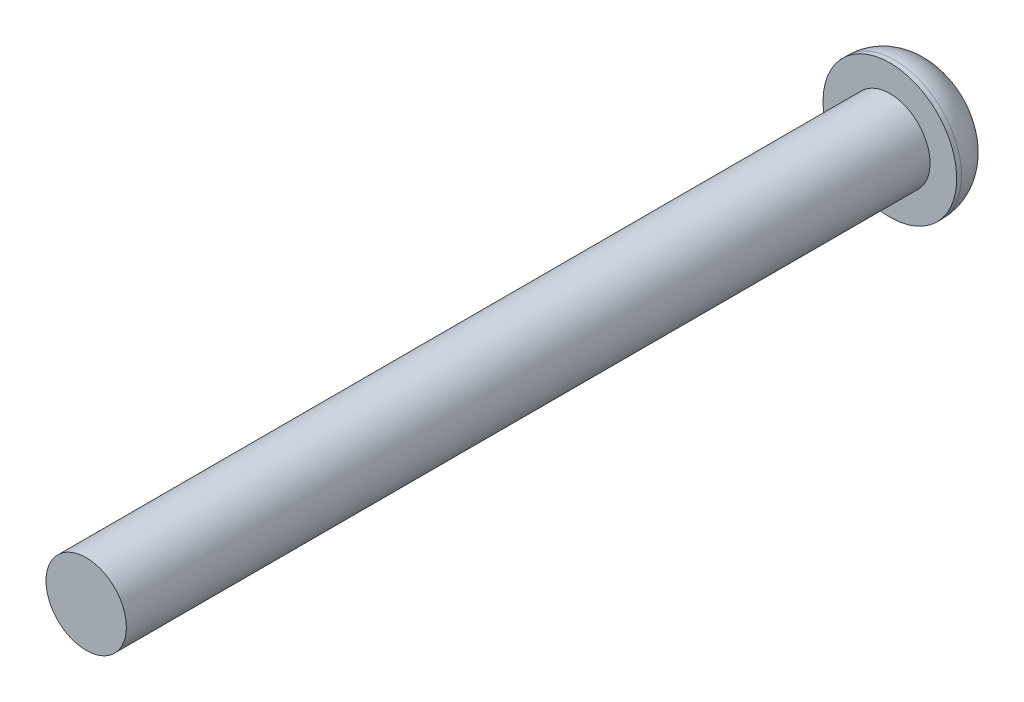
from build123d import *

# Parameters (mm, degrees)
SKETCH1_R           = 2.5
BOSS_EXTRUDE1_DEPTH = 50
SKETCH2_R           = 4.159584877
BOSS_EXTRUDE2_DEPTH = 2.8
FILLET1_R           = 2.5
CUT_EXTRUDE1_DEPTH  = 2


with BuildPart() as part:
    # Sketch1 → Boss-Extrude1 (new body)
    with BuildSketch(Plane.XY):
        Circle(SKETCH1_R)
    extrude(amount=BOSS_EXTRUDE1_DEPTH)

    # Sketch2 → Boss-Extrude2 (add)
    with BuildSketch(Plane(origin=(0, 0, 0), x_dir=(-1, 0, 0), z_dir=(0, 0, -1))):
        Circle(SKETCH2_R)
    extrude(amount=BOSS_EXTRUDE2_DEPTH)

    # Fillet1
    fillet1_edges = [part.edges().sort_by_distance(p)[0] for p in [
        (4.159584877, 0, -2.8),
    ]]
    fillet(fillet1_edges, radius=FILLET1_R)

    # Sketch3 → Cut-Extrude1 (cut)
    with BuildSketch(Plane(origin=(0, 0, -2.8), x_dir=(-1, 0, 0), z_dir=(0, 0, -1))):
        Polygon((1.392434699, -0.636521364), (1.247461021, 0.88762314), (-0.144973678, 1.524144504), (-1.392434699, 0.636521364), (-1.247461021, -0.88762314), (0.144973678, -1.524144504), align=None)
    extrude(amount=-CUT_EXTRUDE1_DEPTH, mode=Mode.SUBTRACT)


solid = part.part
